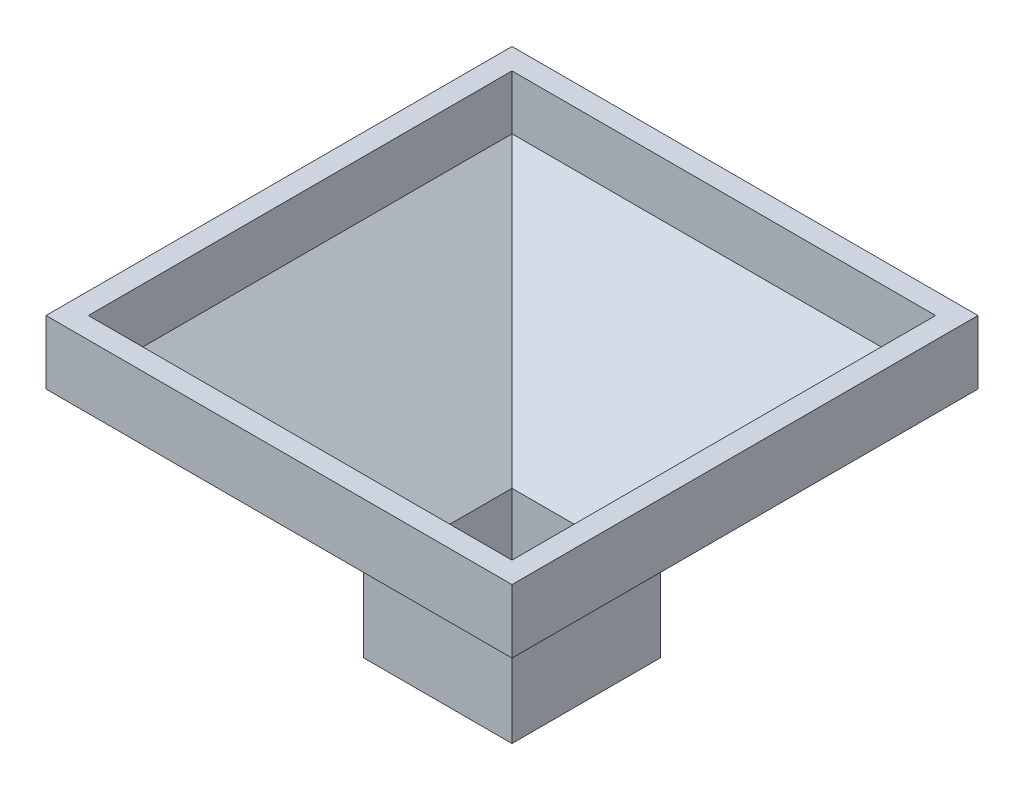
from build123d import *

# Parameters (mm, degrees)
CROQUIS1_W              = 220
CROQUIS1_H              = 220
SALIENTE_EXTRUIR1_DEPTH = 100
CROQUIS2_OUTSIDE_W      = 437.492
CROQUIS2_OUTSIDE_H      = 437.492
CROQUIS2_OUTSIDE_W_2    = 70
CROQUIS2_OUTSIDE_H_2    = 70
CORTAR_EXTRUIR1_DEPTH   = 70
CORTAR_EXTRUIR1_TAPER   = 47
CROQUIS3_W              = 70
CROQUIS3_H              = 70
SALIENTE_EXTRUIR2_DEPTH = 40
VACIADO1_T              = -10
CROQUIS3_3_W            = 50
CROQUIS3_3_H            = 50
CORTAR_EXTRUIR2_DEPTH   = 40


with BuildPart() as part:
    # Croquis1 → Saliente-Extruir1 (new body)
    with BuildSketch(Plane(origin=(0, 0, 0), x_dir=(1, 0, 0), z_dir=(0, 1, 0))):
        Rectangle(CROQUIS1_W, CROQUIS1_H)
    extrude(amount=-SALIENTE_EXTRUIR1_DEPTH)

    # Croquis2 outside → Cortar-Extruir1 (cut)
    with BuildSketch(Plane.XZ.offset(100)):
        Rectangle(CROQUIS2_OUTSIDE_W, CROQUIS2_OUTSIDE_H)
        Rectangle(CROQUIS2_OUTSIDE_W_2, CROQUIS2_OUTSIDE_H_2, mode=Mode.SUBTRACT)
    extrude(amount=-CORTAR_EXTRUIR1_DEPTH, taper=CORTAR_EXTRUIR1_TAPER, mode=Mode.SUBTRACT)

    # Croquis3 → Saliente-Extruir2 (add)
    with BuildSketch(Plane.XZ.offset(100)):
        Rectangle(CROQUIS3_W, CROQUIS3_H)
    extrude(amount=SALIENTE_EXTRUIR2_DEPTH)

    # Vaciado1
    vaciado1_openings = [part.faces().sort_by_distance(p)[0] for p in [
        (0, 0, 0),
    ]]
    offset(amount=VACIADO1_T, openings=vaciado1_openings, kind=Kind.INTERSECTION)

    # Croquis3<3> → Cortar-Extruir2 (cut)
    with BuildSketch(Plane.XZ.offset(100)):
        Rectangle(CROQUIS3_3_W, CROQUIS3_3_H)
    extrude(amount=CORTAR_EXTRUIR2_DEPTH, mode=Mode.SUBTRACT)


solid = part.part
